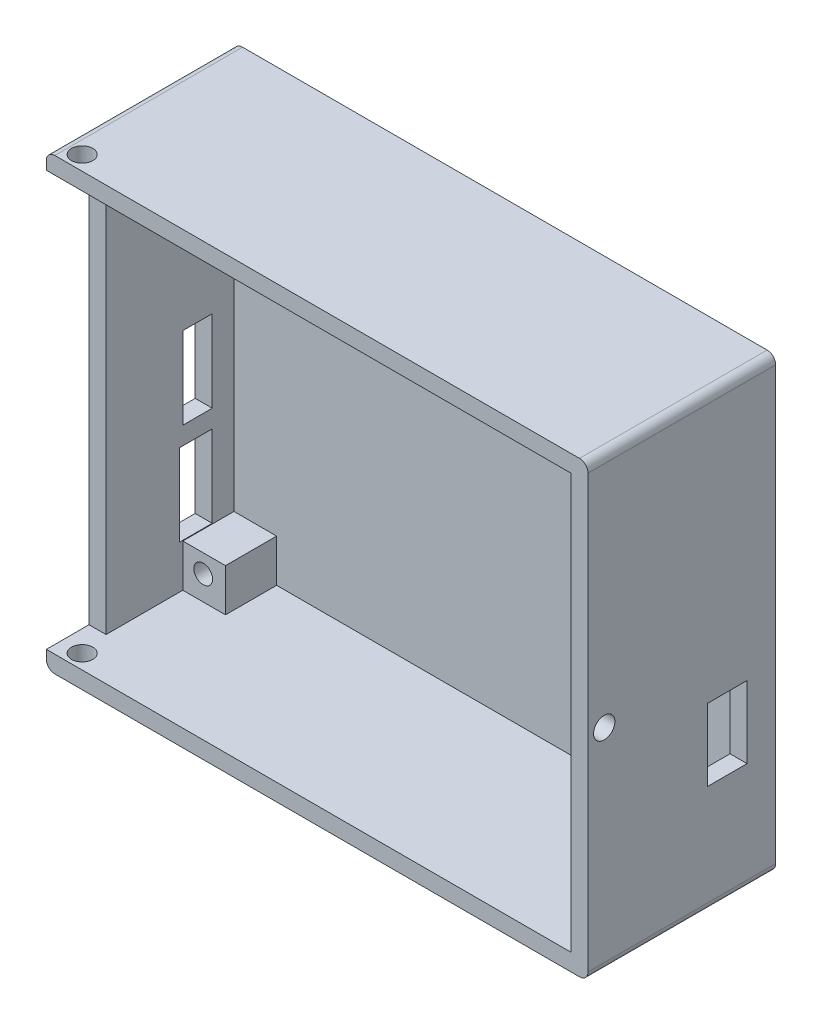
from build123d import *

# Parameters (mm, degrees)
BOSS_EXTRUDE1_START = -40
SKETCH2_W           = 59.507
SKETCH2_H           = 48.644
BOSS_EXTRUDE1_DEPTH = 20
SKETCH3_W           = 63.507
SKETCH3_H           = 52.644
BOSS_EXTRUDE2_DEPTH = 2
SKETCH12_W          = 5
SKETCH12_H          = 5
SKETCH12_W_2        = 6
SKETCH12_H_2        = 5.5
BOSS_EXTRUDE4_DEPTH = 6
SKETCH20_R          = 1.1
CUT_EXTRUDE12_DEPTH = 10
SKETCH23_W          = 5
SKETCH23_H          = 48.644
CUT_EXTRUDE13_DEPTH = 5
SKETCH25_R          = 1.25
CUT_EXTRUDE14_DEPTH = 73
SKETCH27_W          = 4.650000165
SKETCH27_H          = 8.443476487
CUT_EXTRUDE15_DEPTH = 3
SKETCH28_W          = 3.45
SKETCH28_H          = 9.6
SKETCH28_W_2        = 3.86148
SKETCH28_H_2        = 9.589284943
CUT_EXTRUDE16_DEPTH = 3
SKETCH30_R          = 1.25
CUT_EXTRUDE24_DEPTH = 3
FILLET1_R           = 1
FILLET2_R           = 1
FILLET3_R           = 1
FILLET4_R           = 1


with BuildPart() as part:
    # Sketch2 → Boss-Extrude1 (new body)
    with BuildSketch(Plane.XY.offset(BOSS_EXTRUDE1_START)):
        Polygon((60.436010502, 80.424), (121.572, 80.424), (121.572, 27.78), (58.065, 27.78), (58.065, 80.424), align=None)
        with Locations((89.8185, 54.102)):
            Rectangle(SKETCH2_W, SKETCH2_H, mode=Mode.SUBTRACT)
    extrude(amount=BOSS_EXTRUDE1_DEPTH)

    # Sketch3 → Boss-Extrude2 (add)
    with BuildSketch(Plane(origin=(0, 0, -40), x_dir=(-1, 0, 0), z_dir=(0, 0, -1))):
        with Locations((-89.8185, 54.102)):
            Rectangle(SKETCH3_W, SKETCH3_H)
    extrude(amount=BOSS_EXTRUDE2_DEPTH)

    # Sketch12 → Boss-Extrude4 (add)
    with BuildSketch(Plane.XY.offset(-40)):
        with Locations((62.565, 75.924)):
            Rectangle(SKETCH12_W, SKETCH12_H)
        with Locations((116.572, 75.924)):
            Rectangle(SKETCH12_W_2, SKETCH12_H)
        with Locations((117.072, 32.53)):
            Rectangle(SKETCH12_W, SKETCH12_H_2)
        with Locations((62.565, 32.28)):
            Rectangle(SKETCH12_W, SKETCH12_H)
    extrude(amount=BOSS_EXTRUDE4_DEPTH)

    # Sketch20 → Cut-Extrude12 (cut)
    with BuildSketch(Plane.XY.offset(-34)):
        with Locations((62.836, 75.44)):
            Circle(SKETCH20_R)
        with Locations((115.905, 75.538)):
            Circle(SKETCH20_R)
        with Locations((117.094, 33.147)):
            Circle(SKETCH20_R)
        with Locations((62.455, 32.641)):
            Circle(SKETCH20_R)
    extrude(amount=-CUT_EXTRUDE12_DEPTH, mode=Mode.SUBTRACT)

    # Sketch23 → Cut-Extrude13 (cut)
    with BuildSketch(Plane(origin=(60.065, 0, 0), x_dir=(0, 0, -1), z_dir=(1, 0, 0))):
        with Locations((22.5, 54.102)):
            Rectangle(SKETCH23_W, SKETCH23_H)
    extrude(amount=-CUT_EXTRUDE13_DEPTH, mode=Mode.SUBTRACT)

    # Sketch25 → Cut-Extrude14 (cut)
    with BuildSketch(Plane(origin=(0, 80.424, 0), x_dir=(1, 0, 0), z_dir=(0, 1, 0))):
        with Locations(Location((60.565, 21.7, 0), (0, 0, 270))):
            Circle(SKETCH25_R)
    extrude(amount=-CUT_EXTRUDE14_DEPTH, mode=Mode.SUBTRACT)

    # Sketch27 → Cut-Extrude15 (cut)
    with BuildSketch(Plane(origin=(121.572, 0, 0), x_dir=(0, 0, -1), z_dir=(1, 0, 0))):
        with Locations((36.324999988, 44.82384952)):
            Rectangle(SKETCH27_W, SKETCH27_H)
    extrude(amount=-CUT_EXTRUDE15_DEPTH, mode=Mode.SUBTRACT)

    # Sketch28 → Cut-Extrude16 (cut)
    with BuildSketch(Plane.ZY.offset(-58.065)):
        with Locations((-35.725, 51.339048194)):
            Rectangle(SKETCH28_W, SKETCH28_H)
        with Locations((-35.51926, 39.648781472)):
            Rectangle(SKETCH28_W_2, SKETCH28_H_2)
    extrude(amount=-CUT_EXTRUDE16_DEPTH, mode=Mode.SUBTRACT)

    # Sketch30 → Cut-Extrude24 (cut)
    with BuildSketch(Plane(origin=(119.572, 0, 0), x_dir=(0, 0, -1), z_dir=(1, 0, 0))):
        with Locations(Location((21.90078297, 52.638173314, 0), (0, 0, 180))):
            Circle(SKETCH30_R)
    extrude(amount=CUT_EXTRUDE24_DEPTH, mode=Mode.SUBTRACT)

    # Fillet1
    fillet1_edges = [part.edges().sort_by_distance(p)[0] for p in [
        (58.065, 80.424, -31),
    ]]
    fillet(fillet1_edges, radius=FILLET1_R)

    # Fillet2
    fillet2_edges = [part.edges().sort_by_distance(p)[0] for p in [
        (121.572, 80.424, -31),
    ]]
    fillet(fillet2_edges, radius=FILLET2_R)

    # Fillet3
    fillet3_edges = [part.edges().sort_by_distance(p)[0] for p in [
        (121.572, 27.78, -31),
    ]]
    fillet(fillet3_edges, radius=FILLET3_R)

    # Fillet4
    fillet4_edges = [part.edges().sort_by_distance(p)[0] for p in [
        (58.065, 27.78, -31),
    ]]
    fillet(fillet4_edges, radius=FILLET4_R)


solid = part.part
